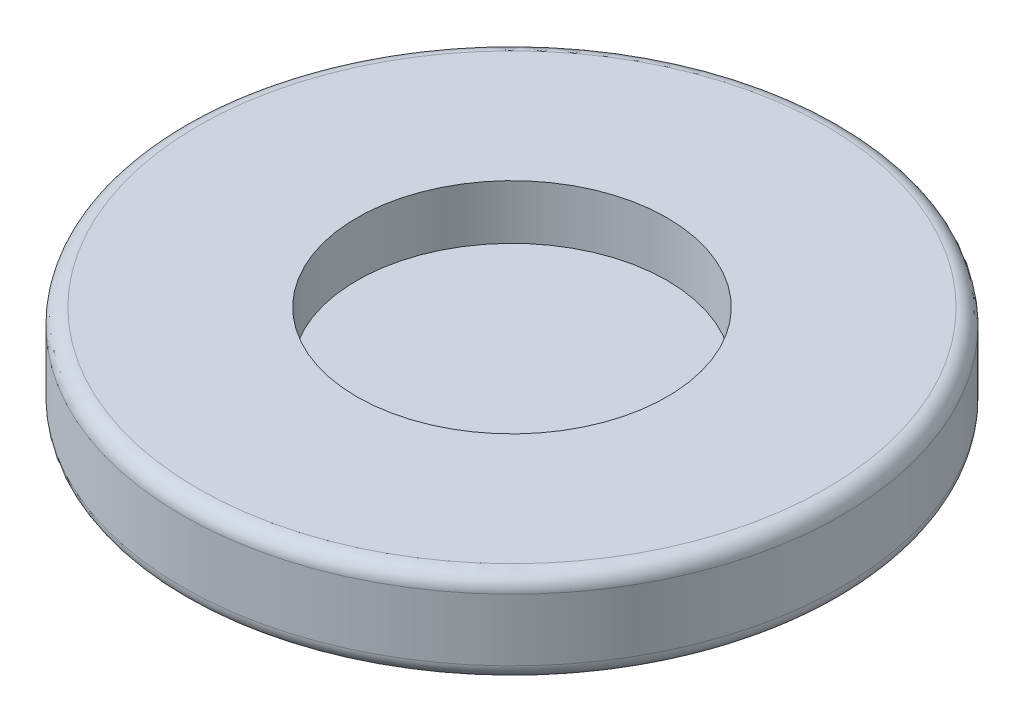
from build123d import *

# Parameters (mm, degrees)
SKETCH1_R           = 42.5
BOSS_EXTRUDE1_DEPTH = 12
SKETCH2_R           = 20
CUT_EXTRUDE1_DEPTH  = 7
FILLET1_R           = 2
FILLET2_R           = 2


with BuildPart() as part:
    # Sketch1 → Boss-Extrude1 (new body)
    with BuildSketch(Plane(origin=(0, 0, 0), x_dir=(1, 0, 0), z_dir=(0, 1, 0))):
        with Locations(Location((0, 0, 0), (0, 0, 270))):
            Circle(SKETCH1_R)
    extrude(amount=BOSS_EXTRUDE1_DEPTH)

    # Sketch2 → Cut-Extrude1 (cut)
    with BuildSketch(Plane(origin=(0, 12, 0), x_dir=(1, 0, 0), z_dir=(0, 1, 0))):
        with Locations(Location((0, 0, 0), (0, 0, 270))):
            Circle(SKETCH2_R)
    extrude(amount=-CUT_EXTRUDE1_DEPTH, mode=Mode.SUBTRACT)

    # Fillet1
    fillet1_edges = [part.edges().sort_by_distance(p)[0] for p in [
        (0, 12, -42.5),
    ]]
    fillet(fillet1_edges, radius=FILLET1_R)

    # Fillet2
    fillet2_edges = [part.edges().sort_by_distance(p)[0] for p in [
        (0, 0, -42.5),
    ]]
    fillet(fillet2_edges, radius=FILLET2_R)


solid = part.part
